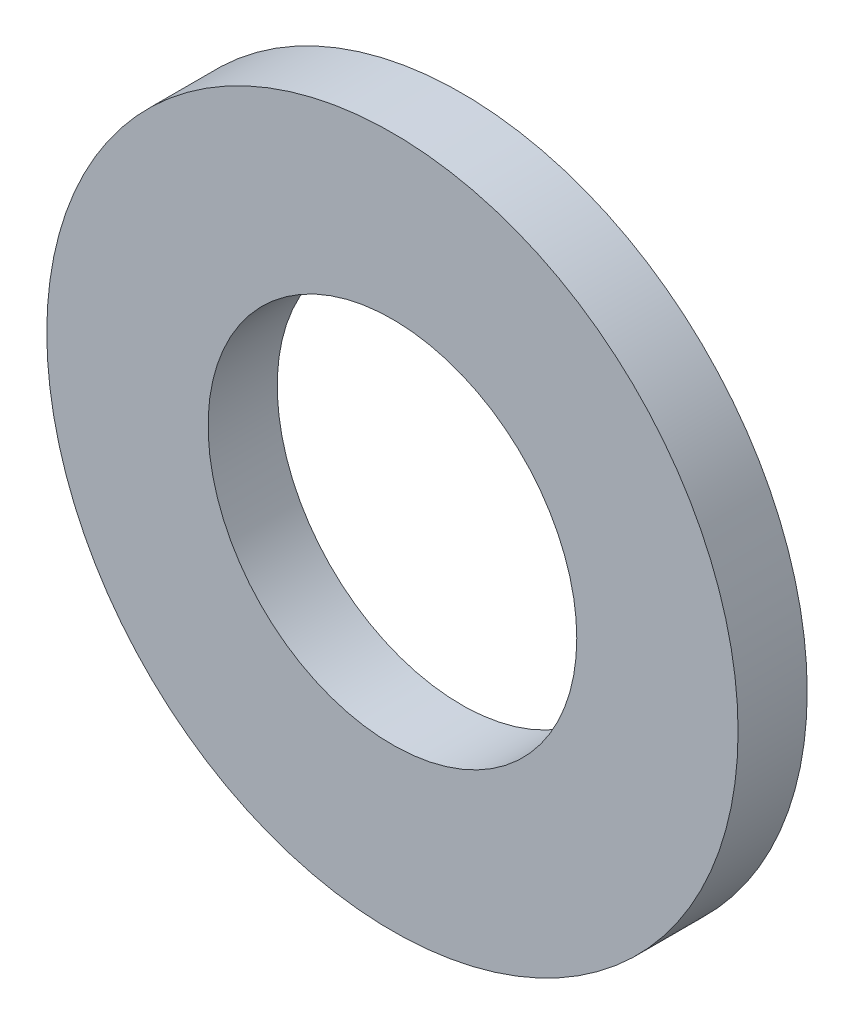
from build123d import *

# Parameters (mm, degrees)
SKETCH1_R           = 6
SKETCH1_R_2         = 3.2
BOSS_EXTRUDE1_DEPTH = 1.2


with BuildPart() as part:
    # Sketch1 → Boss-Extrude1 (new body)
    with BuildSketch(Plane.XY):
        Circle(SKETCH1_R)
        Circle(SKETCH1_R_2, mode=Mode.SUBTRACT)
    extrude(amount=BOSS_EXTRUDE1_DEPTH)


solid = part.part
